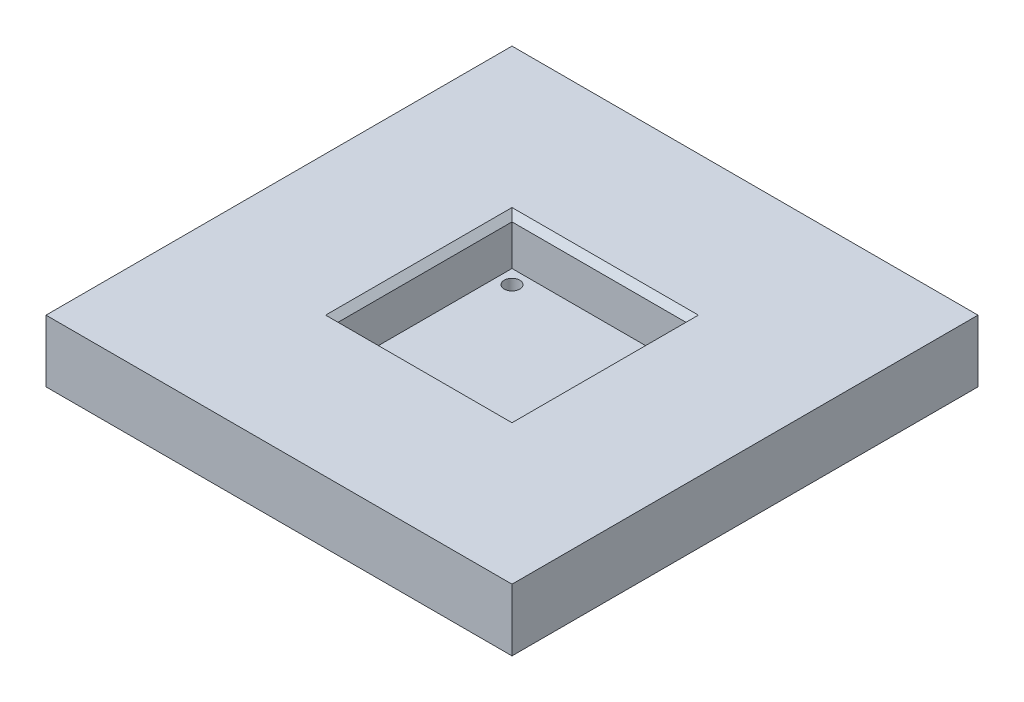
from build123d import *

# Parameters (mm, degrees)
SCHIZZO1_W                   = 150
SCHIZZO1_H                   = 150
ESTRUSIONE_ESTRUSIONE1_DEPTH = 20
SCHIZZO2_W                   = 56
SCHIZZO2_H                   = 56
TAGLIO_ESTRUSIONE1_DEPTH     = 15
SCHIZZO3_R                   = 2.5
TAGLIO_ESTRUSIONE2_DEPTH     = 15
SMUSSO1_SIZE                 = 2
SCHIZZO4_R                   = 5
TAGLIO_ESTRUSIONE3_DEPTH     = 15
SMUSSO2_SIZE                 = 1


with BuildPart() as part:
    # Schizzo1 → Estrusione-Estrusione1 (new body)
    with BuildSketch(Plane(origin=(0, 0, 0), x_dir=(1, 0, 0), z_dir=(0, 1, 0))):
        Rectangle(SCHIZZO1_W, SCHIZZO1_H)
    extrude(amount=ESTRUSIONE_ESTRUSIONE1_DEPTH)

    # Schizzo2 → Taglio-Estrusione1 (cut)
    with BuildSketch(Plane(origin=(0, 20, 0), x_dir=(1, 0, 0), z_dir=(0, 1, 0))):
        Rectangle(SCHIZZO2_W, SCHIZZO2_H)
    extrude(amount=-TAGLIO_ESTRUSIONE1_DEPTH, mode=Mode.SUBTRACT)

    # Schizzo3 → Taglio-Estrusione2 (cut)
    with BuildSketch(Plane(origin=(0, 5, 0), x_dir=(1, 0, 0), z_dir=(0, 1, 0))):
        with Locations(Location((23.5, 23.5, 0), (0, 0, 270))):
            Circle(SCHIZZO3_R)
        with Locations(Location((-23.5, 23.5, 0), (0, 0, 270))):
            Circle(SCHIZZO3_R)
        with Locations(Location((-23.5, -23.5, 0), (0, 0, 270))):
            Circle(SCHIZZO3_R)
        with Locations(Location((23.5, -23.5, 0), (0, 0, 270))):
            Circle(SCHIZZO3_R)
    extrude(amount=-TAGLIO_ESTRUSIONE2_DEPTH, mode=Mode.SUBTRACT)

    # Smusso1
    smusso1_edges = [part.edges().sort_by_distance(p)[0] for p in [
        (28, 20, 0),
        (0, 20, -28),
        (-28, 20, 0),
        (0, 20, 28),
    ]]
    chamfer(smusso1_edges, length=SMUSSO1_SIZE)

    # Schizzo4 → Taglio-Estrusione3 (cut)
    with BuildSketch(Plane(origin=(0, 0, 0), x_dir=(-1, 0, 0), z_dir=(0, -1, 0))):
        with Locations(Location((60, -60, 0), (0, 0, 90))):
            Circle(SCHIZZO4_R)
        with Locations(Location((-60, -60, 0), (0, 0, 270))):
            Circle(SCHIZZO4_R)
        with Locations(Location((-60, 60, 0), (0, 0, 90))):
            Circle(SCHIZZO4_R)
        with Locations(Location((60, 60, 0), (0, 0, 270))):
            Circle(SCHIZZO4_R)
    extrude(amount=-TAGLIO_ESTRUSIONE3_DEPTH, mode=Mode.SUBTRACT)

    # Smusso2
    smusso2_edges = [part.edges().sort_by_distance(p)[0] for p in [
        (-60, 0, 65),
        (60, 0, 55),
        (60, 0, -55),
        (-60, 0, -65),
    ]]
    chamfer(smusso2_edges, length=SMUSSO2_SIZE)


solid = part.part
